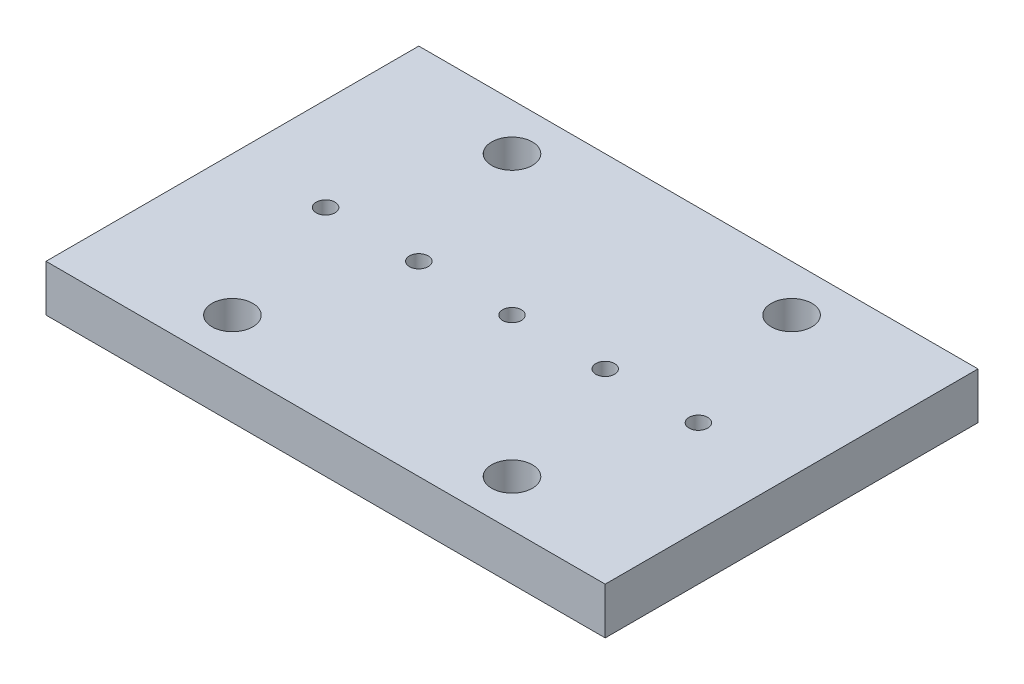
from build123d import *

# Parameters (mm, degrees)
SKETCH1_W                                        = 152.4
SKETCH1_H                                        = 101.6
BOSS_EXTRUDE1_DEPTH                              = 12.7
CBORE_FOR_1_4_SOCKET_HEAD_CAP_SCREW1_D           = 7.14248
CBORE_FOR_1_4_SOCKET_HEAD_CAP_SCREW1_CBORE_D     = 11.1125
CBORE_FOR_1_4_SOCKET_HEAD_CAP_SCREW1_CBORE_DEPTH = 8.89
TAP_DRILL_FOR_1_4_20_TAP1_D                      = 5.1054


with BuildPart() as part:
    # Sketch1 → Boss-Extrude1 (new body)
    with BuildSketch(Plane(origin=(0, 0, 0), x_dir=(1, 0, 0), z_dir=(0, 1, 0))):
        Rectangle(SKETCH1_W, SKETCH1_H)
    extrude(amount=BOSS_EXTRUDE1_DEPTH)

    # CBORE for 1/4 Socket Head Cap Screw1 (through all)
    with Locations(Plane(origin=(0, 12.7, 0), x_dir=(1, 0, 0), z_dir=(0, 1, 0))):
        with Locations((-38.1, 38.1), (38.1, 38.1), (38.1, -38.1), (-38.1, -38.1)):
            CounterBoreHole(CBORE_FOR_1_4_SOCKET_HEAD_CAP_SCREW1_D / 2, CBORE_FOR_1_4_SOCKET_HEAD_CAP_SCREW1_CBORE_D / 2, CBORE_FOR_1_4_SOCKET_HEAD_CAP_SCREW1_CBORE_DEPTH)

    # Tap Drill for 1/4-20 Tap1 (through all)
    with Locations(Plane(origin=(0, 12.7, 0), x_dir=(1, 0, 0), z_dir=(0, 1, 0))):
        with Locations((0, 0), (25.4, 0), (50.8, 0), (-25.4, 0), (-50.8, 0)):
            Hole(TAP_DRILL_FOR_1_4_20_TAP1_D / 2)


solid = part.part
